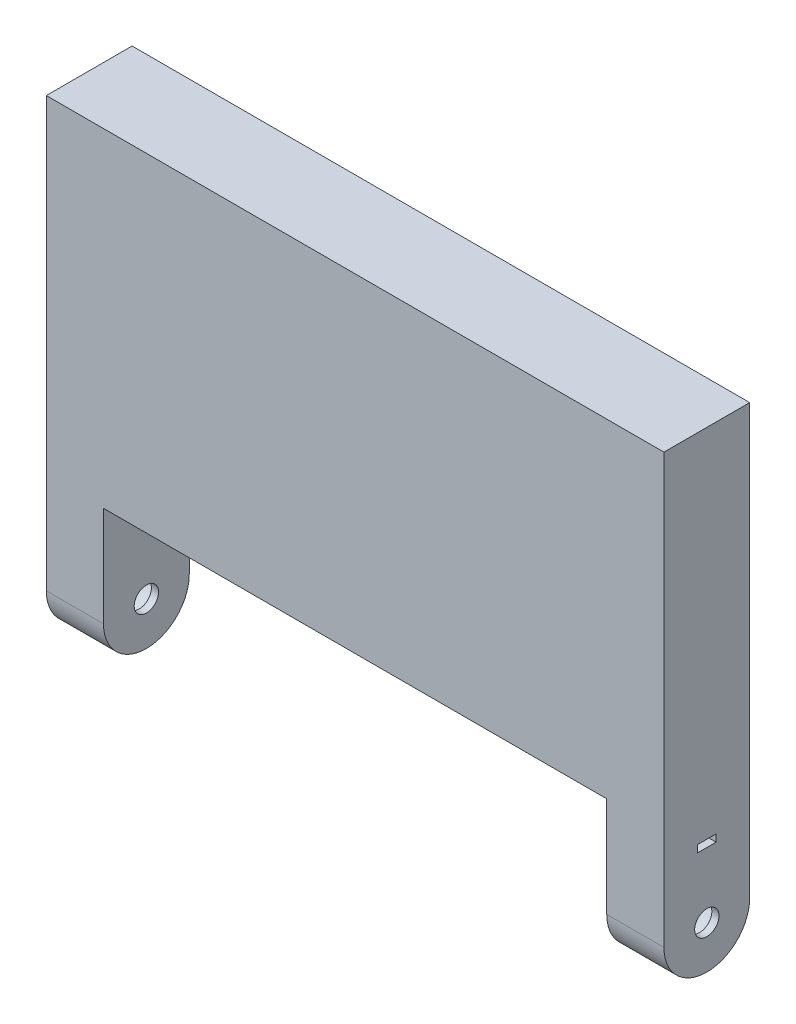
from build123d import *

# Parameters (mm, degrees)
BOSS_EXTRUDE1_START = -216
SKETCH3_W           = 13
SKETCH3_H           = 5
BOSS_EXTRUDE1_DEPTH = 5
BOSS_EXTRUDE2_START = -211
SKETCH3_4_W         = 5
SKETCH3_4_H         = 5
BOSS_EXTRUDE2_DEPTH = 30
BOSS_EXTRUDE3_START = -181
SKETCH3_5_W         = 50
SKETCH3_5_H         = 220
BOSS_EXTRUDE3_DEPTH = 5
BOSS_EXTRUDE4_START = -176
SKETCH3_6_W         = 5
SKETCH3_6_H         = 5
SKETCH3_6_W_2       = 50
BOSS_EXTRUDE4_DEPTH = 176
SKETCH6_R           = 8.5
CUT_EXTRUDE1_DEPTH  = 371.885427053


with BuildPart() as part:
    # Sketch3 → Boss-Extrude1 (new body)
    with BuildSketch(Plane(origin=(0, 0, 0), x_dir=(0, 0, -1), z_dir=(1, 0, 0)).offset(BOSS_EXTRUDE1_START)):
        with BuildLine():
            Line((-30, 0), (-30, 300))
            Line((-30, 300), (30, 300))
            Line((30, 300), (30, 0))
            ThreePointArc((30, 0), (0, -30), (-30, 0))
        make_face()
        with Locations((0, 48)):
            Rectangle(SKETCH3_W, SKETCH3_H, mode=Mode.SUBTRACT)
    extrude(amount=BOSS_EXTRUDE1_DEPTH)

    # Sketch3<4> → Boss-Extrude2 (add)
    with BuildSketch(Plane(origin=(0, 0, 0), x_dir=(0, 0, -1), z_dir=(1, 0, 0)).offset(BOSS_EXTRUDE2_START)):
        Polygon((-30, 300), (-30, 75), (-25, 75), (-25, 295), (25, 295), (25, 75), (30, 75), (30, 300), align=None)
        with BuildLine():
            Line((-30, 70), (-30, 0))
            ThreePointArc((-30, 0), (0, -30), (30, 0))
            Line((30, 0), (30, 70))
            Line((30, 70), (25, 70))
            Line((25, 70), (25, 0))
            ThreePointArc((25, 0), (0, -25), (-25, 0))
            Line((-25, 0), (-25, 70))
            Line((-25, 70), (-30, 70))
        make_face()
        with Locations((-27.5, 72.5)):
            Rectangle(SKETCH3_4_W, SKETCH3_4_H)
        with Locations((27.5, 72.5)):
            Rectangle(SKETCH3_4_W, SKETCH3_4_H)
    extrude(amount=BOSS_EXTRUDE2_DEPTH)

    # Sketch3<5> → Boss-Extrude3 (add)
    with BuildSketch(Plane(origin=(0, 0, 0), x_dir=(0, 0, -1), z_dir=(1, 0, 0)).offset(BOSS_EXTRUDE3_START)):
        with BuildLine():
            ThreePointArc((-30, 0), (0, -30), (30, 0))
            Line((30, 0), (30, 300))
            Line((30, 300), (-30, 300))
            Line((-30, 300), (-30, 0))
        make_face()
        with Locations((0, 185)):
            Rectangle(SKETCH3_5_W, SKETCH3_5_H, mode=Mode.SUBTRACT)
    extrude(amount=BOSS_EXTRUDE3_DEPTH)

    # Sketch3<6> → Boss-Extrude4 (add)
    with BuildSketch(Plane(origin=(0, 0, 0), x_dir=(0, 0, -1), z_dir=(1, 0, 0)).offset(BOSS_EXTRUDE4_START)):
        Polygon((-30, 300), (-30, 75), (-25, 75), (-25, 295), (25, 295), (25, 75), (30, 75), (30, 300), align=None)
        with Locations((-27.5, 72.5)):
            Rectangle(SKETCH3_6_W, SKETCH3_6_H)
        with Locations((0, 72.5)):
            Rectangle(SKETCH3_6_W_2, SKETCH3_6_H)
        with Locations((27.5, 72.5)):
            Rectangle(SKETCH3_6_W, SKETCH3_6_H)
    extrude(amount=BOSS_EXTRUDE4_DEPTH)

    # Sketch6 → Cut-Extrude1 (cut, through all)
    with BuildSketch(Plane(origin=(0, 0, 0), x_dir=(0, 0, -1), z_dir=(1, 0, 0))):
        Circle(SKETCH6_R)
    extrude(amount=-CUT_EXTRUDE1_DEPTH, mode=Mode.SUBTRACT)

    # Mirror5: part across plane


with BuildPart() as part_1:
    add(part.part)
    add(part.part.mirror(Plane(origin=(0, 0, 0), x_dir=(0, 0, 1), z_dir=(1, 0, 0))))


solid = part_1.part
